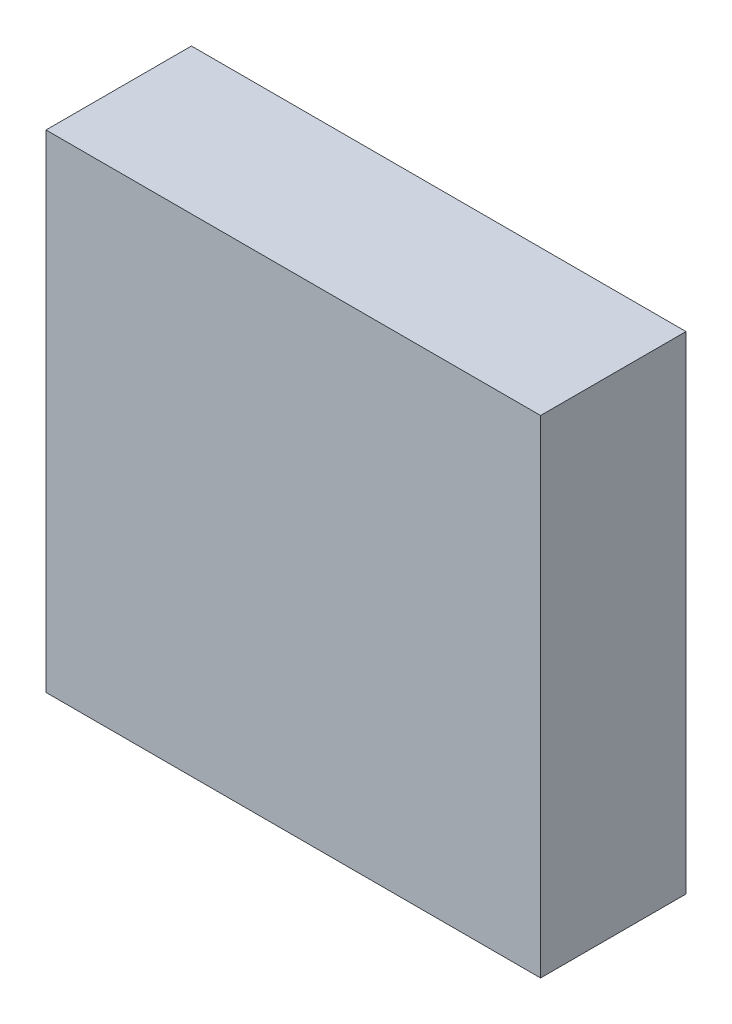
from build123d import *

# Parameters (mm, degrees)
SKETCH1_W               = 3.401
SKETCH1_H               = 3.35
COMPONENT_OUTLINE_DEPTH = 1


with BuildPart() as part:
    # Sketch1 → Component_Outline (new body)
    with BuildSketch(Plane.XY):
        with Locations((-0.0495, -0.075)):
            Rectangle(SKETCH1_W, SKETCH1_H)
    extrude(amount=COMPONENT_OUTLINE_DEPTH)


solid = part.part
